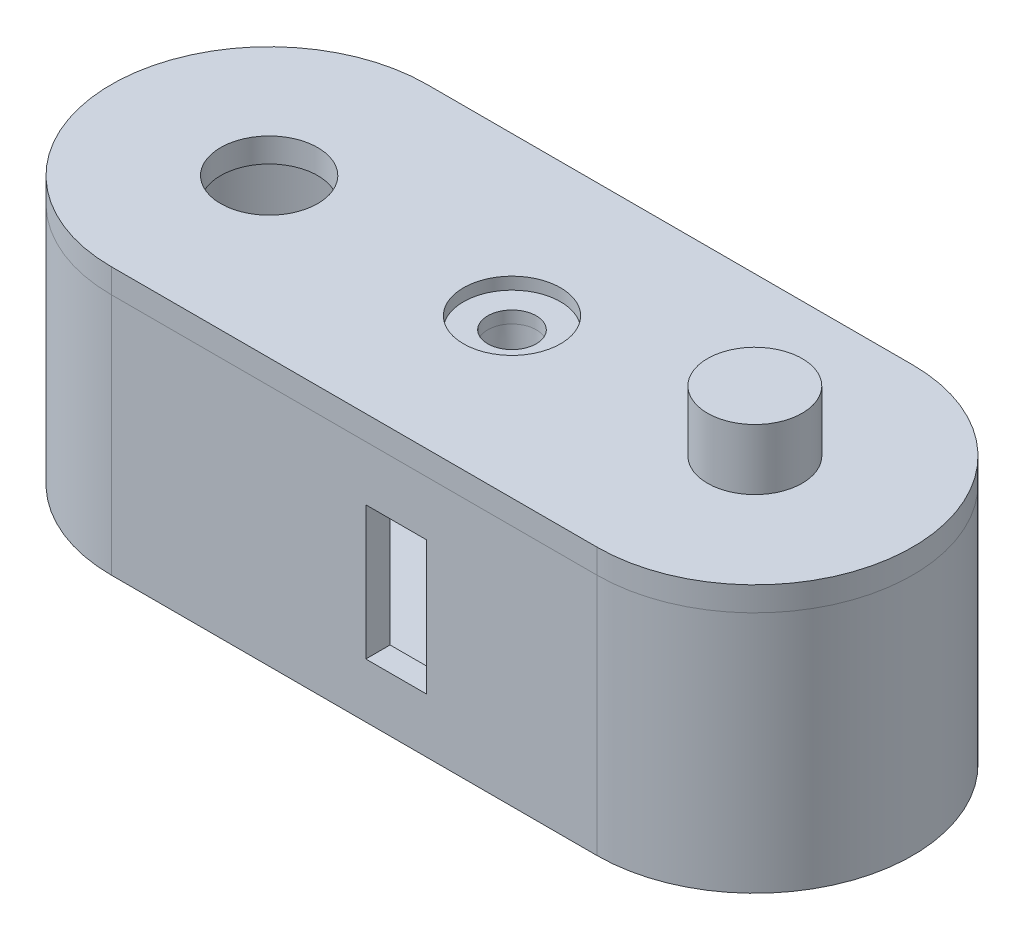
from build123d import *

# Parameters (mm, degrees)
BOSS_EXTRUDE1_DEPTH = 20
SKETCH2_R           = 4
BOSS_EXTRUDE2_DEPTH = 4
SKETCH3_R           = 11
SKETCH3_R_2         = 8.935764158
BOSS_EXTRUDE3_DEPTH = 4
SKETCH4_R           = 3
BOSS_EXTRUDE4_DEPTH = 16
SKETCH5_R           = 2
CUT_EXTRUDE1_DEPTH  = 6
CUT_EXTRUDE1_DRAFT  = -2
SKETCH6_R           = 4
BOSS_EXTRUDE5_DEPTH = 2
SKETCH7_R           = 2
CUT_EXTRUDE2_DEPTH  = 2
SKETCH8_R           = 4
CUT_EXTRUDE3_DEPTH  = 1
SKETCH9_R           = 10.172550013
SKETCH9_R_2         = 8.790782216
BOSS_EXTRUDE6_DEPTH = 7
SKETCH10_R          = 8.790782216
BOSS_EXTRUDE7_DEPTH = 4
SKETCH11_R          = 3.9
BOSS_EXTRUDE8_DEPTH = 5
SKETCH12_R          = 3.9
BOSS_EXTRUDE9_DEPTH = 5
SKETCH13_W          = 5
SKETCH13_H          = 11
CUT_EXTRUDE4_DEPTH  = 2
SKETCH14_W          = 5
SKETCH14_H          = 11
CUT_EXTRUDE5_DEPTH  = 2


with BuildPart() as part:
    # Sketch1 → Boss-Extrude1 (new body)
    with BuildSketch(Plane(origin=(0, 0, 0), x_dir=(1, 0, 0), z_dir=(0, 1, 0))):
        with BuildLine():
            Line((0, 13), (40, 13))
            ThreePointArc((40, 13), (53, 0), (40, -13))
            Line((40, -13), (0, -13))
            ThreePointArc((0, -13), (-13, 0), (0, 13))
        make_face()
        with BuildLine():
            Line((0, 11), (40, 11))
            ThreePointArc((40, 11), (51, 0), (40, -11))
            Line((40, -11), (0, -11))
            ThreePointArc((0, -11), (-11, 0), (0, 11))
        make_face(mode=Mode.SUBTRACT)
    extrude(amount=BOSS_EXTRUDE1_DEPTH)

    # Sketch2 → Boss-Extrude2 (add)
    with BuildSketch(Plane.XZ):
        with BuildLine():
            Line((20, 11), (0, 11))
            ThreePointArc((0, 11), (-11, 0), (0, -11))
            Line((0, -11), (20, -11))
            Line((20, -11), (40, -11))
            ThreePointArc((40, -11), (51, 0), (40, 11))
            Line((40, 11), (20, 11))
        make_face()
        with Locations(Location((40, 0, 0), (0, 0, 270))):
            Circle(SKETCH2_R, mode=Mode.SUBTRACT)
    extrude(amount=-BOSS_EXTRUDE2_DEPTH)

    # Sketch3 → Boss-Extrude3 (add)
    with BuildSketch(Plane(origin=(0, 4, 0), x_dir=(1, 0, 0), z_dir=(0, 1, 0))):
        Circle(SKETCH3_R)
        with Locations(Location((0, 0, 0), (0, 0, 270))):
            Circle(SKETCH3_R_2, mode=Mode.SUBTRACT)
    extrude(amount=BOSS_EXTRUDE3_DEPTH)

    # Sketch4 → Boss-Extrude4 (add)
    with BuildSketch(Plane(origin=(0, 4, 0), x_dir=(1, 0, 0), z_dir=(0, 1, 0))):
        with Locations(Location((20, 0, 0), (0, 0, 90))):
            Circle(SKETCH4_R)
    extrude(amount=BOSS_EXTRUDE4_DEPTH)


with BuildPart() as cut_extrude1_tool:
    # Sketch5 → Cut-Extrude1 (with draft: the straight prism first)
    with BuildSketch(Plane(origin=(0, 20, 0), x_dir=(1, 0, 0), z_dir=(0, 1, 0))):
        with Locations((20, 0)):
            Circle(SKETCH5_R)
    extrude(amount=-CUT_EXTRUDE1_DEPTH)
    # Cut-Extrude1: the draft: its side faces are tilted about the plane it starts from
    cut_extrude1_sides = [cut_extrude1_tool.faces().sort_by_distance(p)[0] for p in [
        (18, 17, 0),
    ]]
    draft(cut_extrude1_sides, Plane(origin=(0, 20, 0), x_dir=(1, 0, 0), z_dir=(0, 1, 0)), CUT_EXTRUDE1_DRAFT)


with BuildPart() as part_1:
    add(part.part)

    # Cut-Extrude1: cut by cut_extrude1_tool
    add(cut_extrude1_tool.part, mode=Mode.SUBTRACT)

    # Sketch11 → Boss-Extrude8 (add)
    with BuildSketch(Plane.XZ):
        with Locations(Location((0, 0, 0), (0, 0, 90))):
            Circle(SKETCH11_R)
    extrude(amount=BOSS_EXTRUDE8_DEPTH)

    # Sketch13 → Cut-Extrude4 (cut)
    with BuildSketch(Plane.XY.offset(13)):
        with Locations((23.459946743, 10)):
            Rectangle(SKETCH13_W, SKETCH13_H)
    extrude(amount=-CUT_EXTRUDE4_DEPTH, mode=Mode.SUBTRACT)

    # Sketch14 → Cut-Extrude5 (cut)
    with BuildSketch(Plane(origin=(0, 0, -13), x_dir=(-1, 0, 0), z_dir=(0, 0, -1))):
        with Locations((-23.459946743, 10)):
            Rectangle(SKETCH14_W, SKETCH14_H)
    extrude(amount=-CUT_EXTRUDE5_DEPTH, mode=Mode.SUBTRACT)


with BuildPart() as body_2:
    # Sketch6 → Boss-Extrude5 (new body)
    with BuildSketch(Plane(origin=(0, 20, 0), x_dir=(1, 0, 0), z_dir=(0, 1, 0))):
        with BuildLine():
            Line((0, 13), (40, 13))
            ThreePointArc((40, 13), (53, 0), (40, -13))
            Line((40, -13), (0, -13))
            ThreePointArc((0, -13), (-13, 0), (0, 13))
        make_face()
        with Locations(Location((0, 0, 0), (0, 0, 270))):
            Circle(SKETCH6_R, mode=Mode.SUBTRACT)
    extrude(amount=BOSS_EXTRUDE5_DEPTH)

    # Sketch7 → Cut-Extrude2 (cut)
    with BuildSketch(Plane(origin=(0, 22, 0), x_dir=(1, 0, 0), z_dir=(0, 1, 0))):
        with Locations(Location((20, 0, 0), (0, 0, 270))):
            Circle(SKETCH7_R)
    extrude(amount=-CUT_EXTRUDE2_DEPTH, mode=Mode.SUBTRACT)

    # Sketch8 → Cut-Extrude3 (cut)
    with BuildSketch(Plane(origin=(0, 22, 0), x_dir=(1, 0, 0), z_dir=(0, 1, 0))):
        with Locations(Location((20, 0, 0), (0, 0, 270))):
            Circle(SKETCH8_R)
    extrude(amount=-CUT_EXTRUDE3_DEPTH, mode=Mode.SUBTRACT)

    # Sketch9 → Boss-Extrude6 (add)
    with BuildSketch(Plane.XZ.offset(-20)):
        with Locations(Location((40, 0, 0), (0, 0, 90))):
            Circle(SKETCH9_R)
        with Locations(Location((40, 0, 0), (0, 0, 270))):
            Circle(SKETCH9_R_2, mode=Mode.SUBTRACT)
    extrude(amount=BOSS_EXTRUDE6_DEPTH)

    # Sketch10 → Boss-Extrude7 (add)
    with BuildSketch(Plane.XZ.offset(-20)):
        with Locations(Location((40, 0, 0), (0, 0, 270))):
            Circle(SKETCH10_R)
    extrude(amount=BOSS_EXTRUDE7_DEPTH)

    # Sketch12 → Boss-Extrude9 (add)
    with BuildSketch(Plane(origin=(0, 22, 0), x_dir=(1, 0, 0), z_dir=(0, 1, 0))):
        with Locations(Location((40, 0, 0), (0, 0, 270))):
            Circle(SKETCH12_R)
    extrude(amount=BOSS_EXTRUDE9_DEPTH)


solid = Compound([part_1.part, body_2.part])
